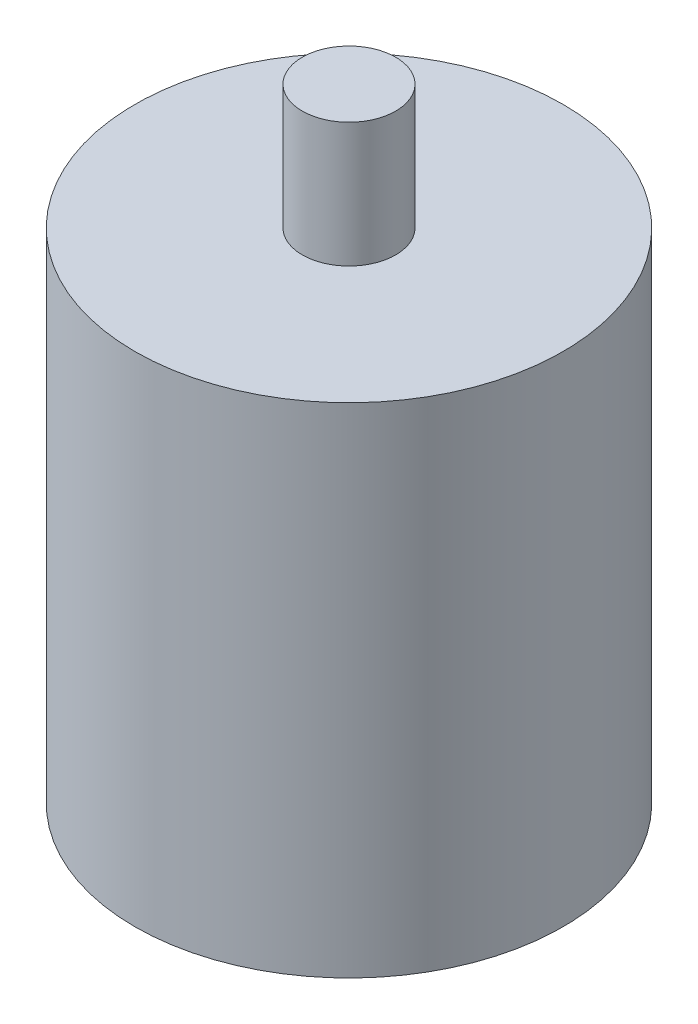
from build123d import *

# Parameters (mm, degrees)
SKETCH1_R           = 13.75
BOSS_EXTRUDE1_DEPTH = 32
SKETCH2_R           = 3
BOSS_EXTRUDE2_DEPTH = 8


with BuildPart() as part:
    # Sketch1 → Boss-Extrude1 (new body)
    with BuildSketch(Plane(origin=(0, 0, 0), x_dir=(1, 0, 0), z_dir=(0, 1, 0))):
        with Locations(Location((0, 0, 0), (0, 0, 270))):
            Circle(SKETCH1_R)
    extrude(amount=BOSS_EXTRUDE1_DEPTH)

    # Sketch2 → Boss-Extrude2 (add)
    with BuildSketch(Plane(origin=(0, 32, 0), x_dir=(1, 0, 0), z_dir=(0, 1, 0))):
        with Locations(Location((0, 0, 0), (0, 0, 270))):
            Circle(SKETCH2_R)
    extrude(amount=BOSS_EXTRUDE2_DEPTH)


solid = part.part
